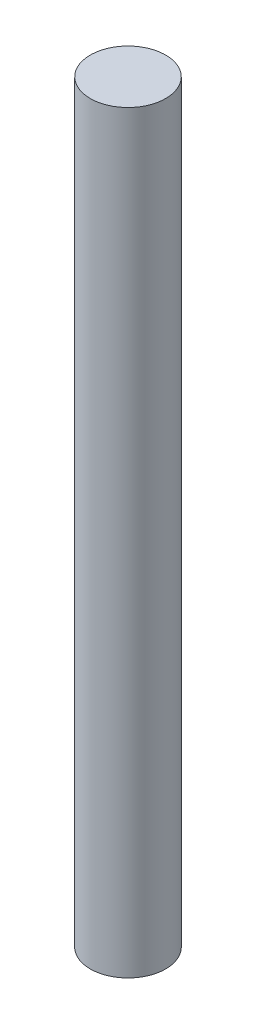
from build123d import *

# Parameters (mm, degrees)
SKETCH1_R           = 12.7
BOSS_EXTRUDE1_DEPTH = 254


with BuildPart() as part:
    # Sketch1 → Boss-Extrude1 (new body)
    with BuildSketch(Plane(origin=(0, 0, 0), x_dir=(1, 0, 0), z_dir=(0, 1, 0))):
        with Locations(Location((0, 0, 0), (0, 0, 270))):
            Circle(SKETCH1_R)
    extrude(amount=BOSS_EXTRUDE1_DEPTH)


solid = part.part
